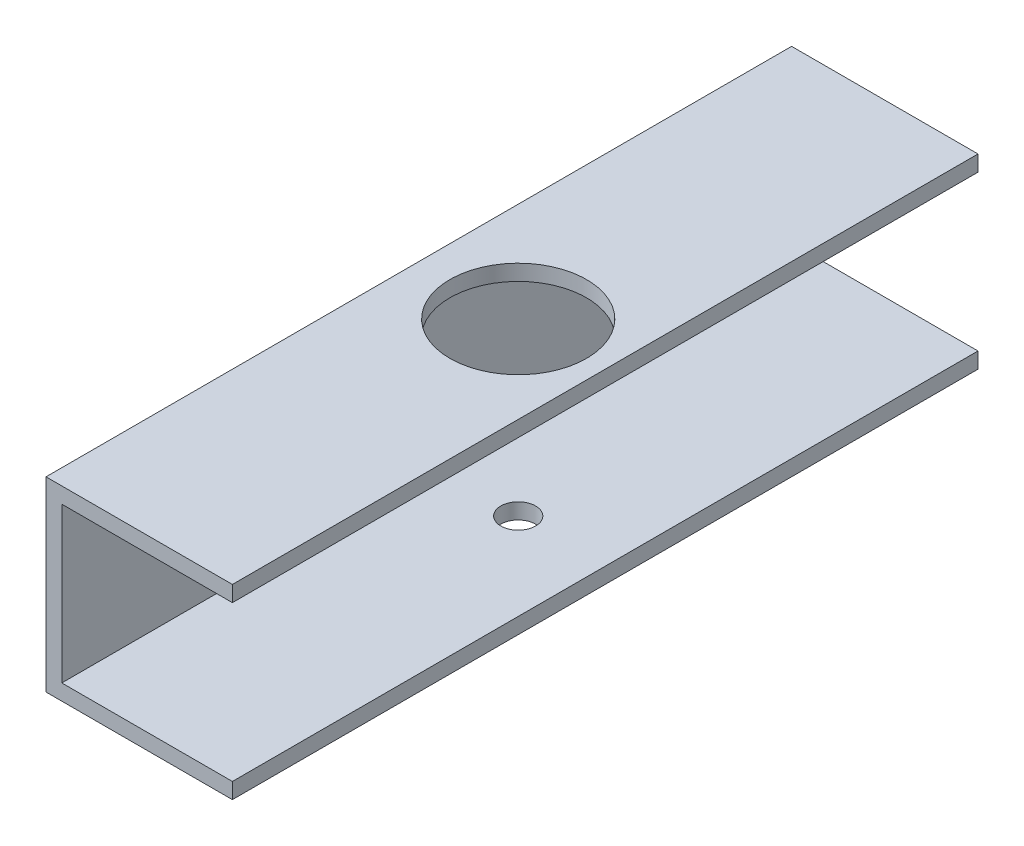
from build123d import *

# Parameters (mm, degrees)
BOSS_EXTRUDE1_DEPTH = 300
SKETCH2_R           = 27.5
CUT_EXTRUDE1_DEPTH  = 10
SKETCH3_R           = 7
CUT_EXTRUDE2_DEPTH  = 10


with BuildPart() as part:
    # Sketch1 → Boss-Extrude1 (new body)
    with BuildSketch(Plane.XY):
        Polygon((0, -37.5), (0, 37.5), (75, 37.5), (75, 31.15), (6.35, 31.15), (6.35, -31.15), (75, -31.15), (75, -37.5), align=None)
    extrude(amount=BOSS_EXTRUDE1_DEPTH)

    # Sketch2 → Cut-Extrude1 (cut)
    with BuildSketch(Plane(origin=(0, 37.5, 0), x_dir=(1, 0, 0), z_dir=(0, 1, 0))):
        with Locations(Location((40, -150, 0), (0, 0, 270))):
            Circle(SKETCH2_R)
    extrude(amount=-CUT_EXTRUDE1_DEPTH, mode=Mode.SUBTRACT)

    # Sketch3 → Cut-Extrude2 (cut)
    with BuildSketch(Plane.XZ.offset(37.5)):
        with Locations(Location((40, 150, 0), (0, 0, 270))):
            Circle(SKETCH3_R)
    extrude(amount=-CUT_EXTRUDE2_DEPTH, mode=Mode.SUBTRACT)


solid = part.part
